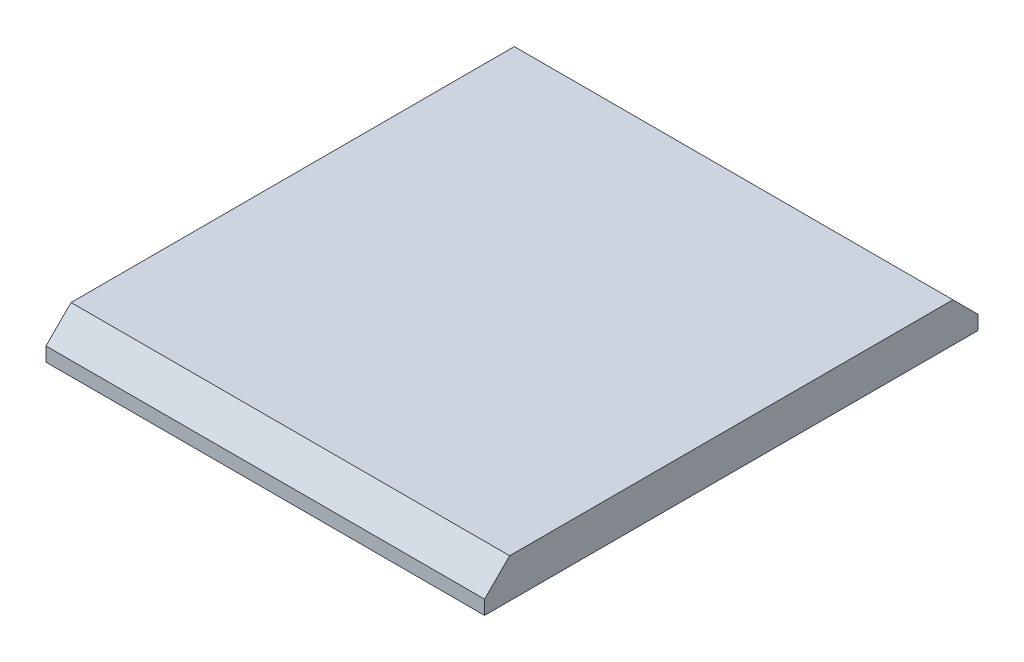
from build123d import *

# Parameters (mm, degrees)
SKETCH1_W           = 355.6
SKETCH1_H           = 400.05
BOSS_EXTRUDE1_DEPTH = 31.75
CUT_EXTRUDE1_DEPTH  = 369.57


with BuildPart() as part:
    # Sketch1 → Boss-Extrude1 (new body)
    with BuildSketch(Plane(origin=(0, 0, 0), x_dir=(1, 0, 0), z_dir=(0, 1, 0))):
        with Locations((177.8, 200.025)):
            Rectangle(SKETCH1_W, SKETCH1_H)
    extrude(amount=BOSS_EXTRUDE1_DEPTH)

    # Sketch2 → Cut-Extrude1 (cut)
    with BuildSketch(Plane(origin=(355.6, 0, 0), x_dir=(0, 0, -1), z_dir=(1, 0, 0))):
        Polygon((0, 31.75), (0, 11.43), (20.32, 31.75), align=None)
        Polygon((400.05, 31.75), (400.05, 11.43), (379.73, 31.75), align=None)
    extrude(amount=-CUT_EXTRUDE1_DEPTH, mode=Mode.SUBTRACT)


solid = part.part
